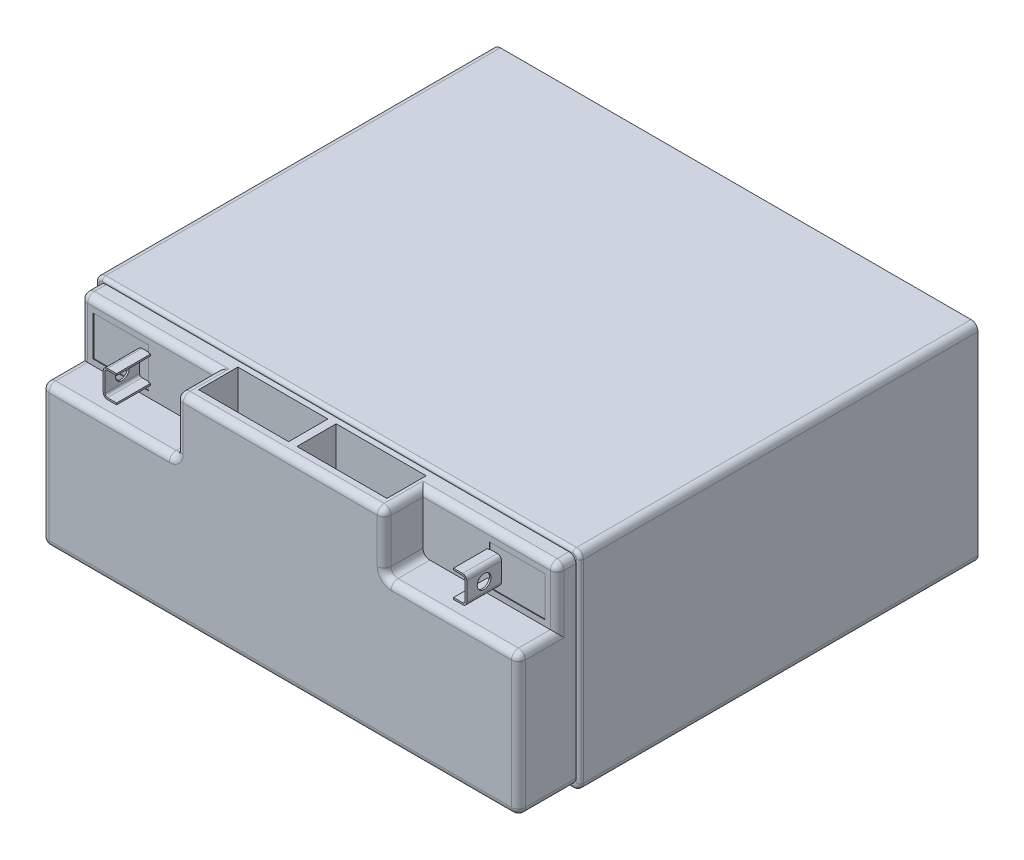
from build123d import *

# Parameters (mm, degrees)
SKETCH1_W           = 177.8
SKETCH1_H           = 146.05
BOSS_EXTRUDE1_DEPTH = 76.2
SKETCH2_W           = 174.845239449
SKETCH2_H           = 73.245239449
BOSS_EXTRUDE2_DEPTH = 21.082
SKETCH3_W           = 14.224
SKETCH3_H           = 21.336
CUT_EXTRUDE1_DEPTH  = 49.276
CUT_EXTRUDE2_DEPTH  = 0.254
SKETCH5_W           = 4.899959439
SKETCH5_H           = 9.93235002
BOSS_EXTRUDE3_DEPTH = 12.446
SKETCH6_W           = 12.446
SKETCH6_H           = 8.710518868
CUT_EXTRUDE3_DEPTH  = 4.289043863
SKETCH7_W           = 3.519901011
SKETCH7_H           = 8.710518868
CUT_EXTRUDE4_DEPTH  = 0.254
SKETCH8_W           = 49.276
SKETCH8_H           = 14.224
CUT_EXTRUDE5_DEPTH  = 21.336
CUT_EXTRUDE6_DEPTH  = 0.254
SKETCH10_W          = 4.899959439
SKETCH10_H          = 9.93235002
BOSS_EXTRUDE4_DEPTH = 12.446
SKETCH11_W          = 12.446
SKETCH11_H          = 8.710518868
CUT_EXTRUDE7_DEPTH  = 4.289043863
SKETCH12_W          = 3.519901012
SKETCH12_H          = 8.710518868
CUT_EXTRUDE8_DEPTH  = 0.254
SKETCH13_W          = 33.02
SKETCH13_H          = 14.399652357
CUT_EXTRUDE9_DEPTH  = 19.05
SKETCH14_W          = 33.02
SKETCH14_H          = 14.399652357
CUT_EXTRUDE10_DEPTH = 19.05
SKETCH15_W          = 63.5
SKETCH15_H          = 15.201284342
CUT_EXTRUDE11_DEPTH = 19.558
SKETCH16_W          = 63.5
SKETCH16_H          = 15.201284342
CUT_EXTRUDE12_DEPTH = 19.558
HOLE1_D             = 5.08
HOLE1_DEPTH         = 0.610915576
HOLE2_D             = 5.08
HOLE2_DEPTH         = 22.805990527
FILLET1_R           = 2.54
FILLET2_R           = 0.913084424
FILLET3_R           = 1.27
FILLET4_R           = 1.524


with BuildPart() as part:
    # Sketch1 → Boss-Extrude1 (new body)
    with BuildSketch(Plane.XZ.offset(62.213215728)):
        with Locations((55.786931477, 73.025)):
            Rectangle(SKETCH1_W, SKETCH1_H)
    extrude(amount=-BOSS_EXTRUDE1_DEPTH)

    # Sketch2 → Boss-Extrude2 (add)
    with BuildSketch(Plane.XY.offset(146.05)):
        with Locations((55.786931477, -24.113215728)):
            Rectangle(SKETCH2_W, SKETCH2_H)
    extrude(amount=BOSS_EXTRUDE2_DEPTH)

    # Sketch3 → Cut-Extrude1 (cut)
    with BuildSketch(Plane.ZY.offset(31.635688247)):
        with Locations((160.02, 1.841403997)):
            Rectangle(SKETCH3_W, SKETCH3_H)
    extrude(amount=-CUT_EXTRUDE1_DEPTH, mode=Mode.SUBTRACT)

    # Sketch4 → Cut-Extrude2 (cut)
    with BuildSketch(Plane.XY.offset(152.908)):
        Polygon((-27.07261505, 7.942830943), (-27.07261505, -6.677584717), (-6.787176985, -6.677584717), (-6.787176985, -4.537418323), (-10.917993572, -4.537418323), (-10.917993572, 5.394931697), (-6.787176985, 5.394931697), (-6.787176985, 7.942830943), align=None)
    extrude(amount=-CUT_EXTRUDE2_DEPTH, mode=Mode.SUBTRACT)

    # Sketch5 → Boss-Extrude3 (add)
    with BuildSketch(Plane.XY.offset(152.908)):
        with Locations((-8.468013853, 0.428756687)):
            Rectangle(SKETCH5_W, SKETCH5_H)
    extrude(amount=BOSS_EXTRUDE3_DEPTH)

    # Sketch6 → Cut-Extrude3 (cut)
    with BuildSketch(Plane(origin=(-6.018034133, 0, 0), x_dir=(0, 0, -1), z_dir=(1, 0, 0))):
        with Locations((-159.131, 0.428756687)):
            Rectangle(SKETCH6_W, SKETCH6_H)
    extrude(amount=-CUT_EXTRUDE3_DEPTH, mode=Mode.SUBTRACT)

    # Sketch7 → Cut-Extrude4 (cut)
    with BuildSketch(Plane.XY.offset(152.908)):
        with Locations((-8.54712749, 0.428756687)):
            Rectangle(SKETCH7_W, SKETCH7_H)
    extrude(amount=-CUT_EXTRUDE4_DEPTH, mode=Mode.SUBTRACT)

    # Sketch8 → Cut-Extrude5 (cut)
    with BuildSketch(Plane(origin=(0, 12.509403997, 0), x_dir=(-1, 0, 0), z_dir=(0, 1, 0))):
        with Locations((-118.571551202, 160.02)):
            Rectangle(SKETCH8_W, SKETCH8_H)
    extrude(amount=-CUT_EXTRUDE5_DEPTH, mode=Mode.SUBTRACT)

    # Sketch9 → Cut-Extrude6 (cut)
    with BuildSketch(Plane.XY.offset(152.908)):
        Polygon((118.361039939, 5.394931697), (122.491856526, 5.394931697), (122.491856526, -4.537418323), (118.361039939, -4.537418323), (118.361039939, -6.677584717), (138.646478004, -6.677584717), (138.646478004, 7.942830943), (118.361039939, 7.942830943), align=None)
    extrude(amount=-CUT_EXTRUDE6_DEPTH, mode=Mode.SUBTRACT)

    # Sketch10 → Boss-Extrude4 (add)
    with BuildSketch(Plane.XY.offset(152.908)):
        with Locations((120.041876806, 0.428756687)):
            Rectangle(SKETCH10_W, SKETCH10_H)
    extrude(amount=BOSS_EXTRUDE4_DEPTH)

    # Sketch11 → Cut-Extrude7 (cut)
    with BuildSketch(Plane.ZY.offset(-117.591897087)):
        with Locations((159.131, 0.428756687)):
            Rectangle(SKETCH11_W, SKETCH11_H)
    extrude(amount=-CUT_EXTRUDE7_DEPTH, mode=Mode.SUBTRACT)

    # Sketch12 → Cut-Extrude8 (cut)
    with BuildSketch(Plane.XY.offset(152.908)):
        with Locations((120.120990445, 0.428756687)):
            Rectangle(SKETCH12_W, SKETCH12_H)
    extrude(amount=-CUT_EXTRUDE8_DEPTH, mode=Mode.SUBTRACT)

    # Sketch13 → Cut-Extrude9 (cut)
    with BuildSketch(Plane(origin=(0, 12.509403997, 0), x_dir=(-1, 0, 0), z_dir=(0, 1, 0))):
        with Locations((-73.820931477, 155.313650768)):
            Rectangle(SKETCH13_W, SKETCH13_H)
    extrude(amount=-CUT_EXTRUDE9_DEPTH, mode=Mode.SUBTRACT)

    # Sketch14 → Cut-Extrude10 (cut)
    with BuildSketch(Plane(origin=(0, 12.509403997, 0), x_dir=(-1, 0, 0), z_dir=(0, 1, 0))):
        with Locations((-37.752931477, 155.313650768)):
            Rectangle(SKETCH14_W, SKETCH14_H)
    extrude(amount=-CUT_EXTRUDE10_DEPTH, mode=Mode.SUBTRACT)

    # Sketch15 → Cut-Extrude11 (cut)
    with BuildSketch(Plane.XZ.offset(60.735835452)):
        with Locations((88.599551202, 155.2427389)):
            Rectangle(SKETCH15_W, SKETCH15_H)
    extrude(amount=-CUT_EXTRUDE11_DEPTH, mode=Mode.SUBTRACT)

    # Sketch16 → Cut-Extrude12 (cut)
    with BuildSketch(Plane.XZ.offset(60.735835452)):
        with Locations((22.974311753, 155.2427389)):
            Rectangle(SKETCH16_W, SKETCH16_H)
    extrude(amount=-CUT_EXTRUDE12_DEPTH, mode=Mode.SUBTRACT)

    # Hole1
    with Locations(Plane(origin=(122.491856526, 0, 0), x_dir=(0, 0, -1), z_dir=(1, 0, 0))):
        with Locations((-159.004, 0.428756687)):
            Hole(HOLE1_D / 2, depth=HOLE1_DEPTH)

    # Hole2
    with Locations(Plane(origin=(-10.307077996, 0, 0), x_dir=(0, 0, -1), z_dir=(1, 0, 0))):
        with Locations((-159.004, 0.428756687)):
            Hole(HOLE2_D / 2, depth=HOLE2_DEPTH)

    # Fillet1
    fillet1_edges = [part.edges().sort_by_distance(p)[0] for p in [
        (144.686931477, 13.986784272, 73.025),
        (55.786931477, 12.509403997, 167.132),
        (143.209551202, 12.509403997, 149.479),
        (143.209551202, -8.826596003, 160.02),
        (143.209551202, 1.841403997, 152.908),
        (118.571551202, -8.826596003, 167.132),
        (93.933551202, -8.826596003, 160.02),
        (93.933551202, 1.841403997, 167.132),
        (118.571551202, 12.509403997, 152.908),
        (93.933551202, 12.509403997, 160.02),
        (-31.635688247, -60.735835452, 156.591),
        (143.209551202, -60.735835452, 156.591),
        (55.786931477, -60.735835452, 167.132),
        (143.209551202, -34.781215728, 167.132),
        (-31.635688247, -34.781215728, 167.132),
        (-31.635688247, 12.509403997, 149.479),
        (17.640311753, 12.509403997, 160.02),
        (-6.997688247, 12.509403997, 152.908),
        (17.640311753, 1.841403997, 167.132),
        (17.640311753, -8.826596003, 160.02),
        (-6.997688247, -8.826596003, 167.132),
        (-31.635688247, 1.841403997, 152.908),
        (-31.635688247, -8.826596003, 160.02),
        (-33.113068523, 13.986784272, 73.025),
        (144.686931477, -62.213215728, 73.025),
        (-33.113068523, -62.213215728, 73.025),
    ]]
    fillet(fillet1_edges, radius=FILLET1_R)

    # Fillet2
    fillet2_edges = [part.edges().sort_by_distance(p)[0] for p in [
        (121.880940951, 4.784016121, 159.004),
        (121.880940951, -3.926502747, 159.004),
        (-10.307077996, -3.926502747, 159.004),
        (-10.307077996, 4.784016121, 159.004),
    ]]
    fillet(fillet2_edges, radius=FILLET2_R)

    # Fillet3
    fillet3_edges = [part.edges().sort_by_distance(p)[0] for p in [
        (-33.113068523, -24.113215728, 146.05),
        (55.786931477, 13.986784272, 146.05),
        (55.786931477, -62.213215728, 146.05),
        (144.686931477, -24.113215728, 146.05),
        (143.942982701, 13.242835496, 146.05),
        (-32.369119747, -61.469266952, 146.05),
        (143.942982701, -61.469266952, 146.05),
        (-32.369119747, 13.242835496, 146.05),
    ]]
    fillet(fillet3_edges, radius=FILLET3_R)

    # Fillet4
    fillet4_edges = [part.edges().sort_by_distance(p)[0] for p in [
        (122.491856526, -4.537418323, 159.004),
        (122.491856526, 5.394931697, 159.004),
        (-10.917993572, 5.394931697, 159.004),
        (-10.917993572, -4.537418323, 159.004),
    ]]
    fillet(fillet4_edges, radius=FILLET4_R)


solid = part.part
